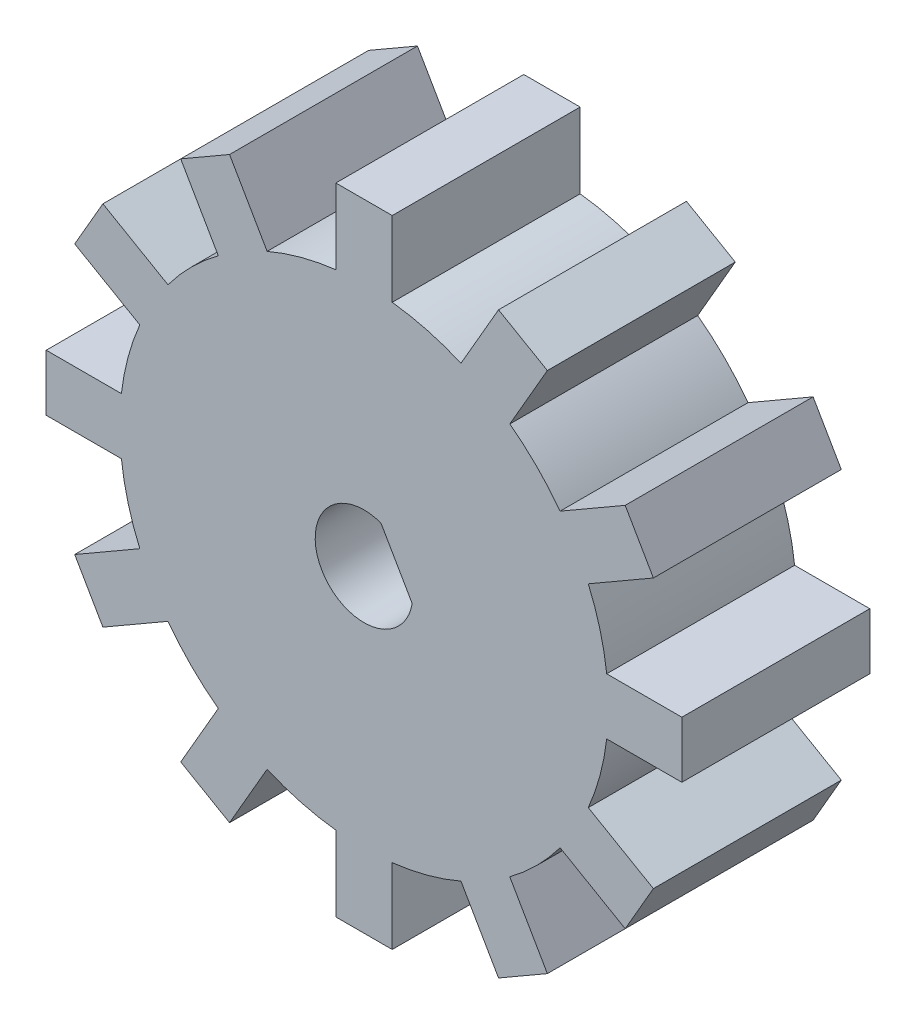
from build123d import *

# Parameters (mm, degrees)
BOSS_EXTRUDE1_DEPTH = 10
CUT_EXTRUDE1_DEPTH  = 10


with BuildPart() as part:
    # Sketch1 → Boss-Extrude1 (new body)
    with BuildSketch(Plane.XY):
        with BuildLine():
            Line((-1.5, 16.91317157), (-1.5, 12.91317157))
            ThreePointArc((-1.5, 12.91317157), (-3.364647586, 12.557035742), (-5.157547679, 11.933134623))
            Line((-5.157547679, 11.933134623), (-7.157547679, 15.397236238))
            Line((-7.157547679, 15.397236238), (-9.755623891, 13.897236238))
            Line((-9.755623891, 13.897236238), (-7.755623891, 10.433134623))
            ThreePointArc((-7.755623891, 10.433134623), (-9.192388155, 9.192388155), (-10.433134623, 7.755623891))
            Line((-10.433134623, 7.755623891), (-13.897236238, 9.755623891))
            Line((-13.897236238, 9.755623891), (-15.397236238, 7.157547679))
            Line((-15.397236238, 7.157547679), (-11.933134623, 5.157547679))
            ThreePointArc((-11.933134623, 5.157547679), (-12.557035742, 3.364647586), (-12.91317157, 1.5))
            Line((-12.91317157, 1.5), (-16.91317157, 1.5))
            Line((-16.91317157, 1.5), (-16.91317157, -1.5))
            Line((-16.91317157, -1.5), (-12.91317157, -1.5))
            ThreePointArc((-12.91317157, -1.5), (-12.557035742, -3.364647586), (-11.933134623, -5.157547679))
            Line((-11.933134623, -5.157547679), (-15.397236238, -7.157547679))
            Line((-15.397236238, -7.157547679), (-13.897236238, -9.755623891))
            Line((-13.897236238, -9.755623891), (-10.433134623, -7.755623891))
            ThreePointArc((-10.433134623, -7.755623891), (-9.192388155, -9.192388155), (-7.755623891, -10.433134623))
            Line((-7.755623891, -10.433134623), (-9.755623891, -13.897236238))
            Line((-9.755623891, -13.897236238), (-7.157547679, -15.397236238))
            Line((-7.157547679, -15.397236238), (-5.157547679, -11.933134623))
            ThreePointArc((-5.157547679, -11.933134623), (-3.364647586, -12.557035742), (-1.5, -12.91317157))
            Line((-1.5, -12.91317157), (-1.5, -16.91317157))
            Line((-1.5, -16.91317157), (1.5, -16.91317157))
            Line((1.5, -16.91317157), (1.5, -12.91317157))
            ThreePointArc((1.5, -12.91317157), (3.364647586, -12.557035742), (5.157547679, -11.933134623))
            Line((5.157547679, -11.933134623), (7.157547679, -15.397236238))
            Line((7.157547679, -15.397236238), (9.755623891, -13.897236238))
            Line((9.755623891, -13.897236238), (7.755623891, -10.433134623))
            ThreePointArc((7.755623891, -10.433134623), (9.192388155, -9.192388155), (10.433134623, -7.755623891))
            Line((10.433134623, -7.755623891), (13.897236238, -9.755623891))
            Line((13.897236238, -9.755623891), (15.397236238, -7.157547679))
            Line((15.397236238, -7.157547679), (11.933134623, -5.157547679))
            ThreePointArc((11.933134623, -5.157547679), (12.557035742, -3.364647586), (12.91317157, -1.5))
            Line((12.91317157, -1.5), (16.91317157, -1.5))
            Line((16.91317157, -1.5), (16.91317157, 1.5))
            Line((16.91317157, 1.5), (12.91317157, 1.5))
            ThreePointArc((12.91317157, 1.5), (12.557035742, 3.364647586), (11.933134623, 5.157547679))
            Line((11.933134623, 5.157547679), (15.397236238, 7.157547679))
            Line((15.397236238, 7.157547679), (13.897236238, 9.755623891))
            Line((13.897236238, 9.755623891), (10.433134623, 7.755623891))
            ThreePointArc((10.433134623, 7.755623891), (9.192388155, 9.192388155), (7.755623891, 10.433134623))
            Line((7.755623891, 10.433134623), (9.755623891, 13.897236238))
            Line((9.755623891, 13.897236238), (7.157547679, 15.397236238))
            Line((7.157547679, 15.397236238), (5.157547679, 11.933134623))
            ThreePointArc((5.157547679, 11.933134623), (3.364647586, 12.557035742), (1.5, 12.91317157))
            Line((1.5, 12.91317157), (1.5, 16.91317157))
            Line((1.5, 16.91317157), (-1.5, 16.91317157))
        make_face()
    extrude(amount=BOSS_EXTRUDE1_DEPTH)

    # Sketch2 → Cut-Extrude1 (cut)
    with BuildSketch(Plane.XY.offset(10)):
        with BuildLine():
            Line((2.562713194, -0.438749457), (0.901388421, 2.438749457))
            ThreePointArc((0.901388421, 2.438749457), (-2.25166605, -1.3), (2.562713194, -0.438749457))
        make_face()
    extrude(amount=-CUT_EXTRUDE1_DEPTH, mode=Mode.SUBTRACT)


solid = part.part
